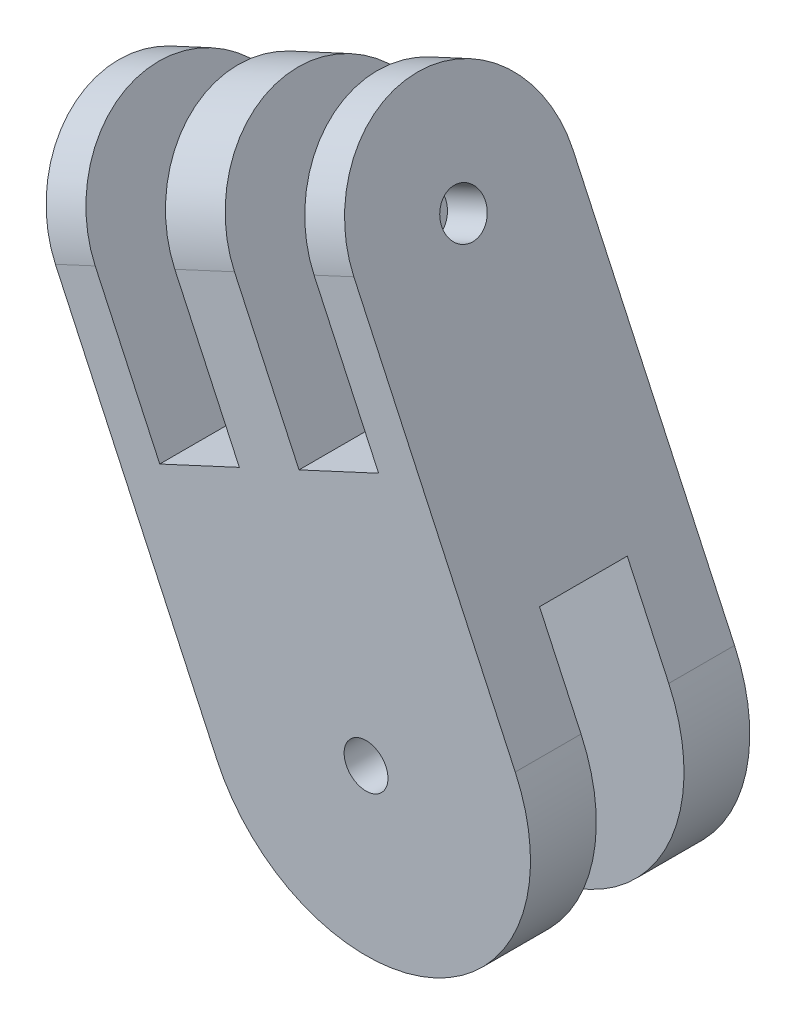
from build123d import *

# Parameters (mm, degrees)
ESQUISSE1_R             = 1
BOSS_EXTRU_1_DEPTH      = 10
ESQUISSE2_W             = 4
ESQUISSE2_H             = 7.5
ESQUISSE2_H_2           = 4.5
ENL_V_MAT_EXTRU_1_DEPTH = 15


with BuildPart() as part:
    # Esquisse1 → Boss.-Extru.1 (new body)
    with BuildSketch(Plane.XY):
        with BuildLine():
            ThreePointArc((-77.855878935, 59.113903977), (-67.897166599, 55.463691844), (-64.246954466, 65.422404179))
            Line((-64.246954466, 65.422404179), (-73.709704769, 85.835790883))
            Line((-73.709704769, 85.835790883), (-75.524228032, 84.994657522))
            Line((-75.524228032, 84.994657522), (-70.47742787, 74.107517947))
            Line((-70.47742787, 74.107517947), (-74.106474395, 72.425251227))
            Line((-74.106474395, 72.425251227), (-79.153274557, 83.312390802))
            Line((-79.153274557, 83.312390802), (-81.875059451, 82.050690761))
            Line((-81.875059451, 82.050690761), (-76.828259289, 71.163551186))
            Line((-76.828259289, 71.163551186), (-80.457305814, 69.481284466))
            Line((-80.457305814, 69.481284466), (-85.504105976, 80.368424041))
            Line((-85.504105976, 80.368424041), (-87.318629238, 79.52729068))
            Line((-87.318629238, 79.52729068), (-77.855878935, 59.113903977))
        make_face()
        with Locations((-71.0514167, 62.268154078)):
            Circle(ESQUISSE1_R, mode=Mode.SUBTRACT)
    extrude(amount=BOSS_EXTRU_1_DEPTH)

    # Esquisse2 → Enlèv. mat.-Extru.1 (cut)
    with BuildSketch(Plane(origin=(-41.529278226, -19.251151014, 0), x_dir=(0, 0, 1), z_dir=(-0.9072616312569987, -0.42056668014583576, 0))):
        with BuildLine():
            Line((5, 108.875365486), (0, 108.875365486))
            Line((0, 108.875365486), (0, 103.875365486))
            ThreePointArc((0, 103.875365486), (1.464466094, 107.410899392), (5, 108.875365486))
        make_face()
        with BuildLine():
            Line((10, 108.875365486), (5, 108.875365486))
            ThreePointArc((5, 108.875365486), (8.535533906, 107.410899392), (10, 103.875365486))
            Line((10, 103.875365486), (10, 108.875365486))
        make_face()
        with BuildLine():
            ThreePointArc((6, 103.875365486), (5, 104.875365486), (4, 103.875365486))
            Line((4, 103.875365486), (6, 103.875365486))
        make_face()
        with BuildLine():
            Line((6, 103.875365486), (4, 103.875365486))
            ThreePointArc((4, 103.875365486), (5, 102.875365486), (6, 103.875365486))
        make_face()
        with Locations((5, 82.625365486)):
            Rectangle(ESQUISSE2_W, ESQUISSE2_H)
        with Locations((5, 88.625365486)):
            Rectangle(ESQUISSE2_W, ESQUISSE2_H_2)
    extrude(amount=-ENL_V_MAT_EXTRU_1_DEPTH, mode=Mode.SUBTRACT)


solid = part.part
